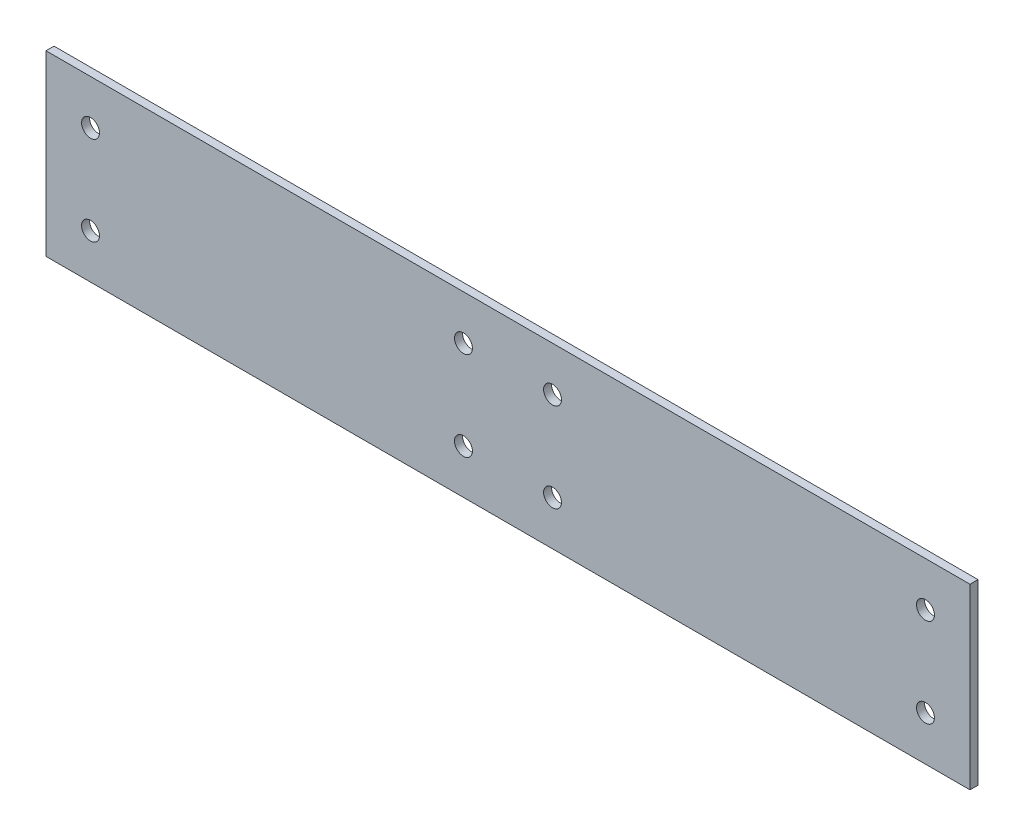
from build123d import *

# Parameters (mm, degrees)
SKETCH1_W              = 263.525
SKETCH1_H              = 50.8
BOSS_EXTRUDE1_DEPTH    = 1.143
F_10_CLEARANCE_HOLE1_D = 5.1054


with BuildPart() as part:
    # Sketch1 → Boss-Extrude1 (new, symmetric)
    with BuildSketch(Plane.XY):
        Rectangle(SKETCH1_W, SKETCH1_H)
    extrude(amount=BOSS_EXTRUDE1_DEPTH, both=True)

    # #10 Clearance Hole1 (through all)
    with Locations(Plane.XY.offset(1.143)):
        with Locations((-119.0625, 12.7), (-119.0625, -12.7), (-12.7, 12.7), (-12.7, -12.7), (12.7, -12.7), (12.7, 12.7), (119.0625, 12.7), (119.0625, -12.7)):
            Hole(F_10_CLEARANCE_HOLE1_D / 2)


solid = part.part
